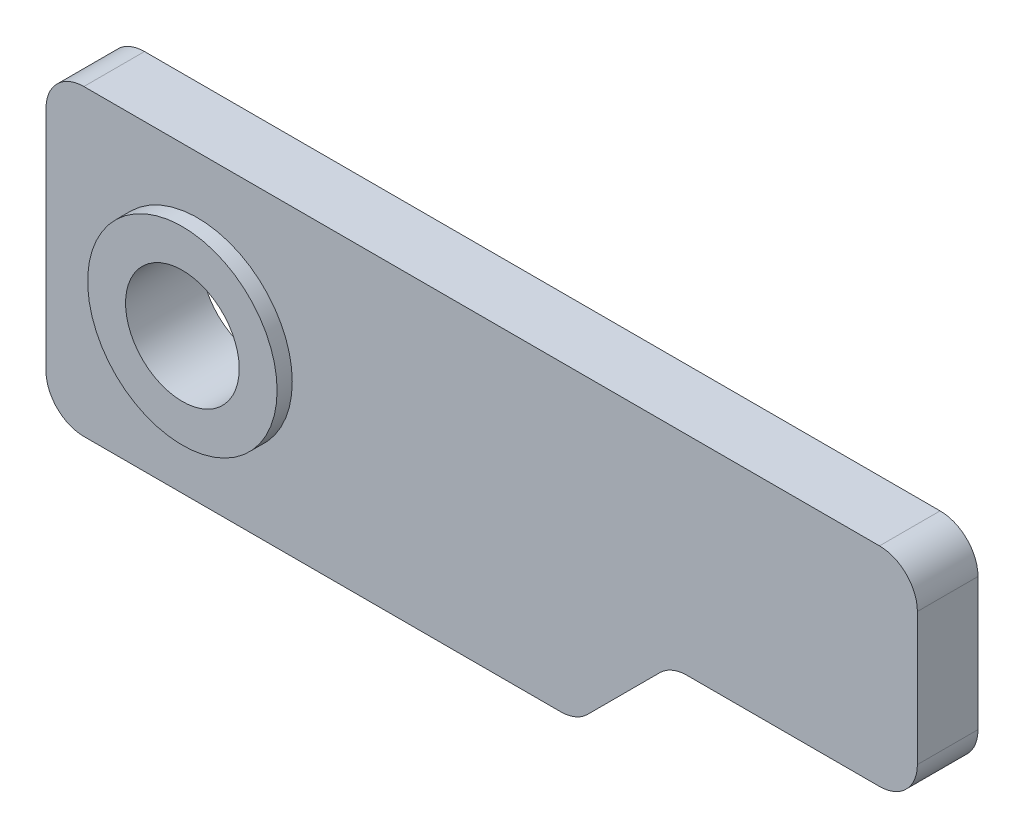
from build123d import *

# Parameters (mm, degrees)
SKETCH1_R           = 1.5
BOSS_EXTRUDE1_DEPTH = 2
SKETCH2_R           = 2.5
CUT_EXTRUDE1_DEPTH  = 0.4
FILLET1_R           = 1


with BuildPart() as part:
    # Sketch1 → Boss-Extrude1 (new body)
    with BuildSketch(Plane.XY):
        Polygon((11.5, -1.5), (5, -1.5), (2.5, -4), (-11.5, -4), (-11.5, 4), (11.5, 4), align=None)
        with Locations((-7.5, 0)):
            Circle(SKETCH1_R, mode=Mode.SUBTRACT)
    extrude(amount=BOSS_EXTRUDE1_DEPTH)

    # Sketch2 → Cut-Extrude1 (cut)
    with BuildSketch(Plane.XY.offset(2)):
        Polygon((-11.5, 4), (-11.5, -4), (2.5, -4), (5, -1.5), (11.5, -1.5), (11.5, 4), align=None)
        with Locations((-7.5, 0)):
            Circle(SKETCH2_R, mode=Mode.SUBTRACT)
    extrude(amount=-CUT_EXTRUDE1_DEPTH, mode=Mode.SUBTRACT)

    # Fillet1
    fillet1_edges = [part.edges().sort_by_distance(p)[0] for p in [
        (-11.5, 4, 0.8),
        (11.5, 4, 0.8),
        (11.5, -1.5, 0.8),
        (5, -1.5, 0.8),
        (2.5, -4, 0.8),
        (-11.5, -4, 0.8),
    ]]
    fillet(fillet1_edges, radius=FILLET1_R)


solid = part.part
